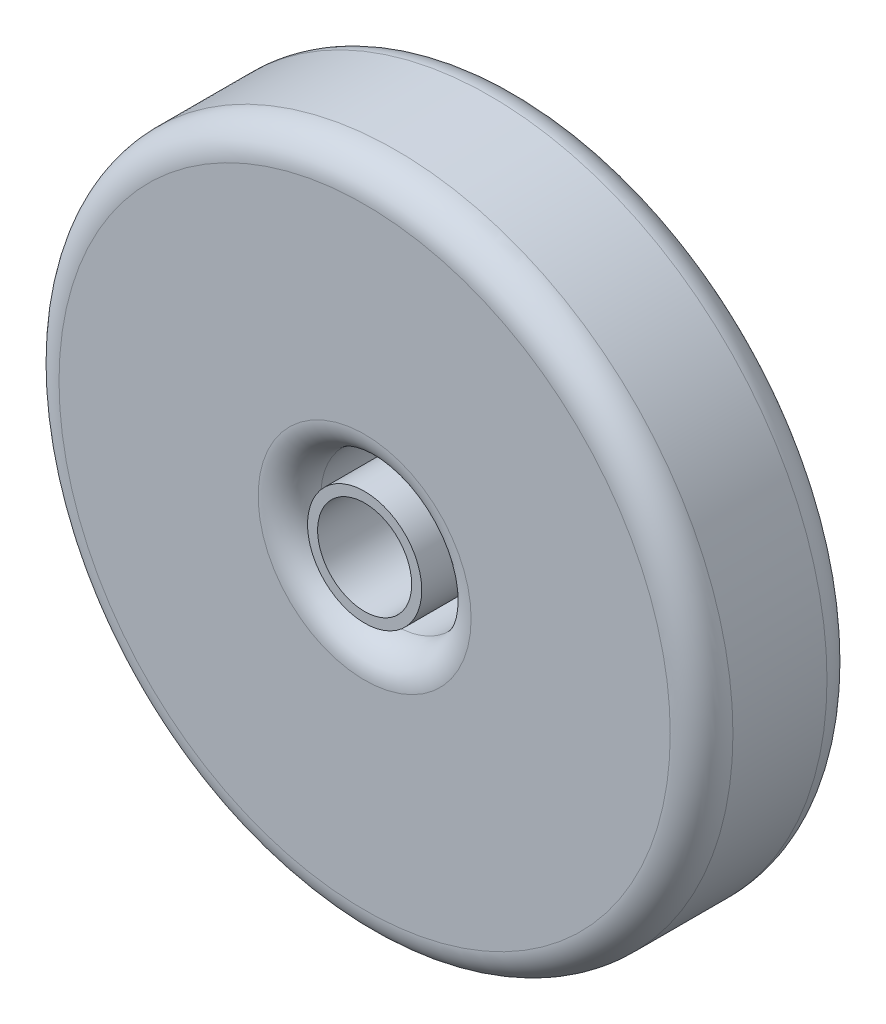
from build123d import *

# Parameters (mm, degrees)
SKETCH1_R           = 27.305
SKETCH1_R_2         = 3.81
BOSS_EXTRUDE1_DEPTH = 12.7
SKETCH2_R           = 6.089197758
SKETCH2_R_2         = 4.626410668
CUT_EXTRUDE1_DEPTH  = 10.16
FILLET2_R           = 2.54
FILLET3_R           = 2.54


with BuildPart() as part:
    # Sketch1 → Boss-Extrude1 (new body)
    with BuildSketch(Plane.XY):
        Circle(SKETCH1_R)
        Circle(SKETCH1_R_2, mode=Mode.SUBTRACT)
    extrude(amount=BOSS_EXTRUDE1_DEPTH)

    # Sketch2 → Cut-Extrude1 (cut)
    with BuildSketch(Plane.XY.offset(12.7)):
        Circle(SKETCH2_R)
        Circle(SKETCH2_R_2, mode=Mode.SUBTRACT)
    extrude(amount=-CUT_EXTRUDE1_DEPTH, mode=Mode.SUBTRACT)

    # Fillet2
    fillet2_edges = [part.edges().sort_by_distance(p)[0] for p in [
        (-6.089197758, 0, 12.7),
        (-27.305, 0, 12.7),
    ]]
    fillet(fillet2_edges, radius=FILLET2_R)

    # Fillet3
    fillet3_edges = [part.edges().sort_by_distance(p)[0] for p in [
        (-27.305, 0, 0),
    ]]
    fillet(fillet3_edges, radius=FILLET3_R)


solid = part.part
